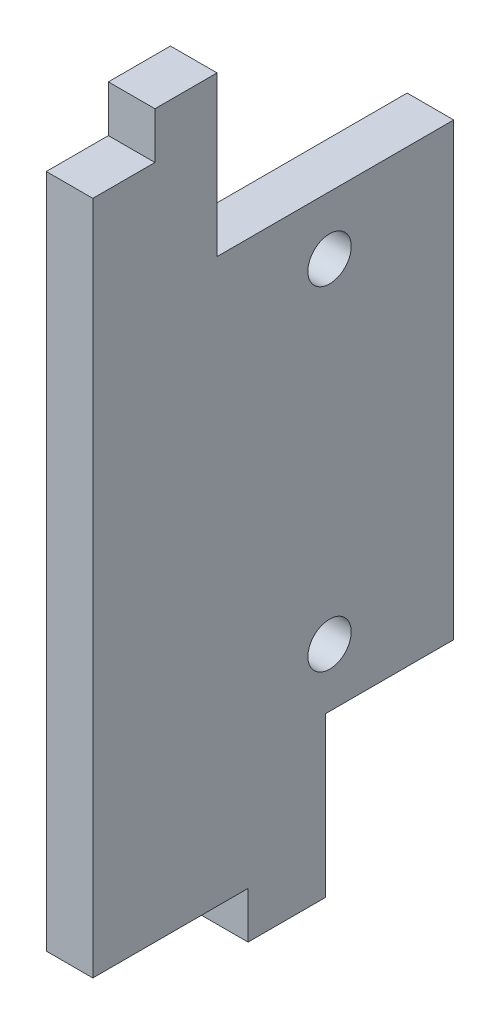
from build123d import *

# Parameters (mm, degrees)
SKETCH1_W             = 15
SKETCH1_H             = 49.5
BOSS_EXTRUDE1_DEPTH   = 3
SKETCH2_W             = 10
SKETCH2_H             = 3
SKETCH2_W_2           = 7
SKETCH2_H_2           = 10.25
SKETCH2_W_3           = 4
CUT_EXTRUDE1_DEPTH    = 27.034832437
SKETCH3_W             = 3
SKETCH3_H             = 29
BOSS_EXTRUDE2_DEPTH   = 8.25
F_3_CLEARANCE_HOLE1_D = 2.794


with BuildPart() as part:
    # Sketch1 → Boss-Extrude1 (new body)
    with BuildSketch(Plane(origin=(0, 0, 0), x_dir=(0, 0, -1), z_dir=(1, 0, 0))):
        Rectangle(SKETCH1_W, SKETCH1_H)
    extrude(amount=BOSS_EXTRUDE1_DEPTH)

    # Sketch2 → Cut-Extrude1 (cut, through all)
    with BuildSketch(Plane.ZY):
        with Locations((2.5, -23.25)):
            Rectangle(SKETCH2_W, SKETCH2_H)
        with Locations((-4, 19.625)):
            Rectangle(SKETCH2_W_2, SKETCH2_H_2)
        with Locations((5.5, 23.25)):
            Rectangle(SKETCH2_W_3, SKETCH2_H)
    extrude(amount=-CUT_EXTRUDE1_DEPTH, mode=Mode.SUBTRACT)

    # Sketch3 → Boss-Extrude2 (add)
    with BuildSketch(Plane(origin=(0, 0, -7.5), x_dir=(-1, 0, 0), z_dir=(0, 0, -1))):
        with Locations((-1.5, 0)):
            Rectangle(SKETCH3_W, SKETCH3_H)
    extrude(amount=BOSS_EXTRUDE2_DEPTH)

    # #3 Clearance Hole1 (through all)
    with Locations(Plane.ZY):
        with Locations((-7.75, 10.75), (-7.75, -10.75)):
            Hole(F_3_CLEARANCE_HOLE1_D / 2)


solid = part.part
